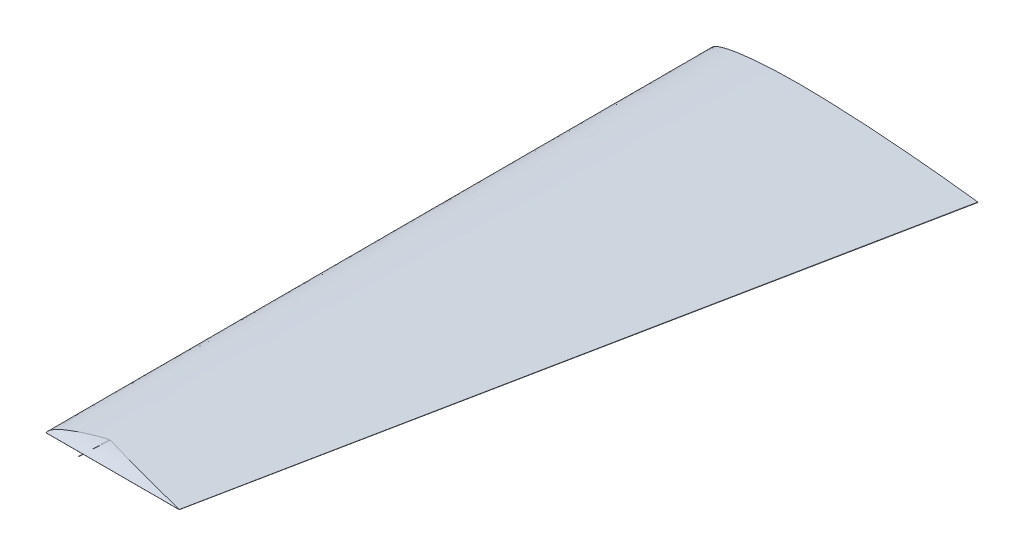
from build123d import *

# Parameters (mm, degrees)
CUT_EXTRUDE3_DEPTH = 124


with BuildPart() as part:
    # Sketch8 → Loft3 section 0
    with BuildSketch(Plane.XY.offset(500)):
        with BuildLine():
            add(Edge.make_bspline(
                [(100, -0.08), (100.0982003, -0.08), (100.0982003, 0), (100.0982003, 0.08), (100, 0.08)],
                knots=[4.71238898, 4.71238898, 4.71238898, 6.283185307, 6.283185307, 7.853981634, 7.853981634, 7.853981634], degree=2, weights=[1, 0.707106781, 1, 0.707106781, 1]))
            add(Edge.make_bspline(
                [(100, 0.08), (98.340466343, 0.290554896), (95.020075081, 0.711832664), (88.367066975, 1.461111617), (80.044783911, 2.340991399), (70.042018792, 3.209683957), (60.035698152, 3.95959195), (50.021269895, 4.530222255), (39.993687201, 4.919679947), (31.625774727, 4.996905547), (24.924282842, 4.841612636), (19.902045273, 4.594402976), (14.879525224, 4.201509171), (10.709171986, 3.712867098), (7.37606212, 3.154718725), (4.892191024, 2.634842874), (2.764771035, 2.002586955), (1.104596609, 1.374755566), (-0.664953668, -0.03164864), (1.228475023, -1.261178162), (2.933481266, -1.728176773), (5.096027037, -2.160688432), (7.600818069, -2.476412386), (10.944440272, -2.758722273), (15.106579217, -2.975175789), (20.092914843, -3.082794275), (25.073344536, -3.112937235), (31.707283293, -3.049534144), (40.011481521, -2.889560409), (49.985234319, -2.578220754), (59.971004018, -2.156017771), (69.964312978, -1.697111032), (79.964057863, -1.193976405), (88.303873939, -0.753426461), (94.983968373, -0.384285875), (98.326754181, -0.18150356), (100, -0.08)],
                knots=[0, 0, 0, 0, 0.024859697, 0.049739227, 0.099493774, 0.149221854, 0.198943346, 0.248609854, 0.2982794, 0.348064935, 0.372939434, 0.397887123, 0.422783956, 0.447785096, 0.460293957, 0.472915307, 0.485735635, 0.492389976, 0.501193712, 0.509994103, 0.516620358, 0.529356672, 0.54189737, 0.554378737, 0.57913368, 0.603859612, 0.628479773, 0.653149817, 0.702447764, 0.751909179, 0.801437946, 0.850977488, 0.900576014, 0.950231651, 0.975088239, 1, 1, 1, 1], degree=3))
        make_face()
    # Sketch1 → Loft3 section 1
    with BuildSketch(Plane.XY):
        with BuildLine():
            add(Edge.make_bspline(
                [(200.010080815, -0.169400102), (200.199199383, -0.16073795), (200.194290269, 0.004541752), (200.189381154, 0.169821455), (200, 0.17)],
                knots=[1.624292012, 1.624292012, 1.624292012, 3.168340496, 3.168340496, 4.71238898, 4.71238898, 4.71238898], degree=2, weights=[1, 0.716500053, 1, 0.716500053, 1]))
            add(Edge.make_bspline(
                [(200, 0.17), (196.67746604, 0.586668366), (190.032625306, 1.419976608), (176.728227903, 2.926057493), (160.084175509, 4.659920637), (140.089189156, 6.440767193), (120.07407578, 7.914172421), (100.045962927, 9.061776054), (79.987385072, 9.838318802), (63.248100853, 9.995924185), (49.848929727, 9.67965264), (39.803308698, 9.20441105), (29.766094955, 8.400560173), (21.418771198, 7.422612273), (14.748722178, 6.310885624), (9.776151548, 5.27330599), (5.531325518, 3.997766679), (2.202803508, 2.762593198), (-1.32901831, -0.064251043), (2.456132017, -2.522294641), (5.871252454, -3.45570584), (10.196542856, -4.337399818), (15.206171707, -4.947610022), (21.888608284, -5.520443609), (30.206290628, -5.96118593), (40.185803884, -6.179814241), (50.146674245, -6.21892414), (63.418045304, -6.119709778), (80.02310567, -5.77750732), (99.966383809, -5.137663307), (119.939251517, -4.329433955), (139.925177362, -3.401624295), (159.931809305, -2.40156831), (176.614241921, -1.506763536), (189.977649107, -0.766432974), (196.66351869, -0.368550354), (200.010080815, -0.169400102)],
                knots=[0, 0, 0, 0, 0.024881027, 0.049760353, 0.099487298, 0.149219338, 0.198913901, 0.24860473, 0.298273869, 0.348058996, 0.372958053, 0.397854843, 0.422778143, 0.447754492, 0.460312099, 0.472933346, 0.485729837, 0.492374205, 0.501196281, 0.5099966, 0.516622801, 0.529388214, 0.541925605, 0.554357523, 0.579138345, 0.603839313, 0.628508671, 0.653153559, 0.702451581, 0.751913366, 0.801414973, 0.850978851, 0.900576971, 0.95025825, 0.975114634, 1.000025012, 1.000025012, 1.000025012, 1.000025012], degree=3))
        make_face()
    loft()

    # Sketch30 → Cut-Extrude3 (cut)
    with BuildSketch(Plane(origin=(0, 0, 0), x_dir=(0, 0, -1), z_dir=(1, 0, 0))):
        with BuildLine():
            Line((-500, 4.958382219), (-500, 0.050406))
            add(Edge.make_bspline(
                [(-500, 0.050406), (-493.951656901, 4.84006767), (-485.878042071, 5.098407649)],
                knots=[0, 0, 0, 0.927348249, 0.927348249, 0.927348249], degree=2))
            Line((-485.878042071, 5.098407649), (-500, 4.958382219))
        make_face()
        with BuildLine():
            add(Edge.make_bspline(
                [(-500, 0), (-496.628488842, -3.033339473), (-491.979592326, -3.150092909)],
                knots=[0, 0, 0, 1, 1, 1], degree=2))
            Line((-500, 0), (-500, -3.100451691))
            Line((-500, -3.100451691), (-491.979592326, -3.150092909))
        make_face()
    extrude(amount=CUT_EXTRUDE3_DEPTH, mode=Mode.SUBTRACT)


solid = part.part
